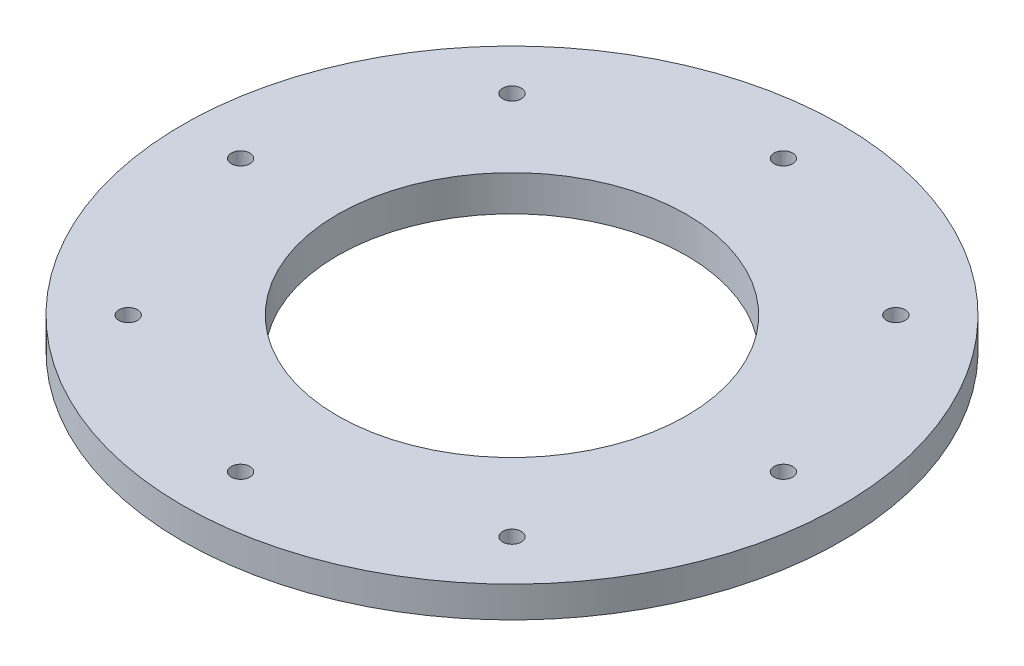
from build123d import *

# Parameters (mm, degrees)
SKETCH1_R           = 40
BOSS_EXTRUDE1_DEPTH = 0.6
SKETCH2_R           = 42.5
BOSS_EXTRUDE2_DEPTH = 4
SKETCH3_R           = 22.5
CUT_EXTRUDE1_DEPTH  = 61.279847379
SKETCH4_R           = 1.2
CUT_EXTRUDE4_DEPTH  = 61.279847379


with BuildPart() as part:
    # Sketch1 → Boss-Extrude1 (new body)
    with BuildSketch(Plane(origin=(0, 0, 0), x_dir=(1, 0, 0), z_dir=(0, 1, 0))):
        with Locations(Location((0, 0, 0), (0, 0, 270))):
            Circle(SKETCH1_R)
    extrude(amount=BOSS_EXTRUDE1_DEPTH)

    # Sketch2 → Boss-Extrude2 (add)
    with BuildSketch(Plane(origin=(0, 0.6, 0), x_dir=(1, 0, 0), z_dir=(0, 1, 0))):
        with Locations(Location((0, 0, 0), (0, 0, 270))):
            Circle(SKETCH2_R)
    extrude(amount=BOSS_EXTRUDE2_DEPTH)

    # Sketch3 → Cut-Extrude1 (cut, through all)
    with BuildSketch(Plane.XZ):
        with Locations(Location((0, 0, 0), (0, 0, 270))):
            Circle(SKETCH3_R)
    extrude(amount=-CUT_EXTRUDE1_DEPTH, mode=Mode.SUBTRACT)

    # Sketch4 → Cut-Extrude4 (cut, through all)
    with BuildSketch(Plane.XZ):
        with Locations(Location((0, 35, 0), (0, 0, 270))):
            Circle(SKETCH4_R)
        with Locations(Location((24.748737342, 24.748737342, 0), (0, 0, 270))):
            Circle(SKETCH4_R)
        with Locations(Location((35, 0, 0), (0, 0, 270))):
            Circle(SKETCH4_R)
        with Locations(Location((24.748737342, -24.748737342, 0), (0, 0, 270))):
            Circle(SKETCH4_R)
        with Locations(Location((0, -35, 0), (0, 0, 270))):
            Circle(SKETCH4_R)
        with Locations(Location((-24.748737342, -24.748737342, 0), (0, 0, 270))):
            Circle(SKETCH4_R)
        with Locations(Location((-35, 0, 0), (0, 0, 270))):
            Circle(SKETCH4_R)
        with Locations(Location((-24.748737342, 24.748737342, 0), (0, 0, 270))):
            Circle(SKETCH4_R)
    extrude(amount=-CUT_EXTRUDE4_DEPTH, mode=Mode.SUBTRACT)


solid = part.part
